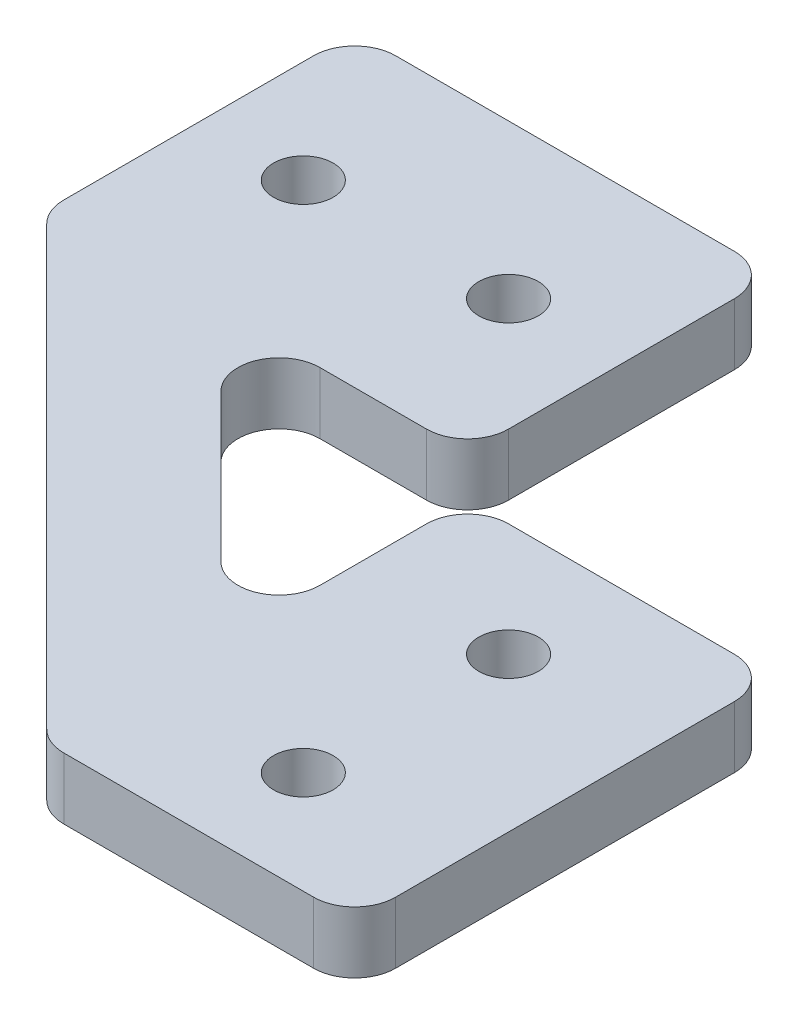
from build123d import *

# Parameters (mm, degrees)
SKETCH_1_R          = 1.45
EXTRUDE_1_DEPTH     = 3
EXTRUDE_2_DEPTH     = 3
SKETCH_3_W          = 17
SKETCH_3_H          = 17
CUT_EXTRUDE_1_DEPTH = 54.117793629
FILLET_1_R          = 2


with BuildPart() as part:
    # 草图1 → 凸台-拉伸1 (new body)
    with BuildSketch(Plane(origin=(0, 0, 0), x_dir=(1, 0, 0), z_dir=(0, 1, 0))):
        Polygon((0, 0), (-37.5, 0), (-37.5, -15), (-15, -15), (-15, -37.5), (0, -37.5), align=None)
        with Locations(Location((-7.5, -7.5, 0), (0, 0, 270))):
            Circle(SKETCH_1_R, mode=Mode.SUBTRACT)
        with Locations(Location((-22.5, -7.5, 0), (0, 0, 270))):
            Circle(SKETCH_1_R, mode=Mode.SUBTRACT)
        with Locations(Location((-32.5, -7.5, 0), (0, 0, 270))):
            Circle(SKETCH_1_R, mode=Mode.SUBTRACT)
        with Locations(Location((-7.5, -22.5, 0), (0, 0, 270))):
            Circle(SKETCH_1_R, mode=Mode.SUBTRACT)
        with Locations(Location((-7.5, -32.5, 0), (0, 0, 270))):
            Circle(SKETCH_1_R, mode=Mode.SUBTRACT)
    extrude(amount=EXTRUDE_1_DEPTH)

    # 草图2 → 凸台-拉伸2 (add)
    with BuildSketch(Plane(origin=(0, 3, 0), x_dir=(1, 0, 0), z_dir=(0, 1, 0))):
        Polygon((-37.5, -15), (-15, -37.5), (-15, -29.014718626), (-29.014718626, -15), align=None)
    extrude(amount=-EXTRUDE_2_DEPTH)

    # 草图3 → 切除-拉伸1 (cut, through all)
    with BuildSketch(Plane(origin=(0, 3, 0), x_dir=(1, 0, 0), z_dir=(0, 1, 0))):
        with Locations((-8.5, -8.5)):
            Rectangle(SKETCH_3_W, SKETCH_3_H)
    extrude(amount=-CUT_EXTRUDE_1_DEPTH, mode=Mode.SUBTRACT)

    # 圆角1
    fillet_1_edges = [part.edges().sort_by_distance(p)[0] for p in [
        (0, 1.5, 37.5),
        (-15, 1.5, 37.5),
        (-37.5, 1.5, 15),
        (-37.5, 1.5, 0),
        (-29.014718626, 1.5, 15),
        (-15, 1.5, 29.014718626),
        (-15, 1.5, 17),
        (-17, 1.5, 15),
        (0, 1.5, 17),
        (-17, 1.5, 0),
    ]]
    fillet(fillet_1_edges, radius=FILLET_1_R)


solid = part.part
